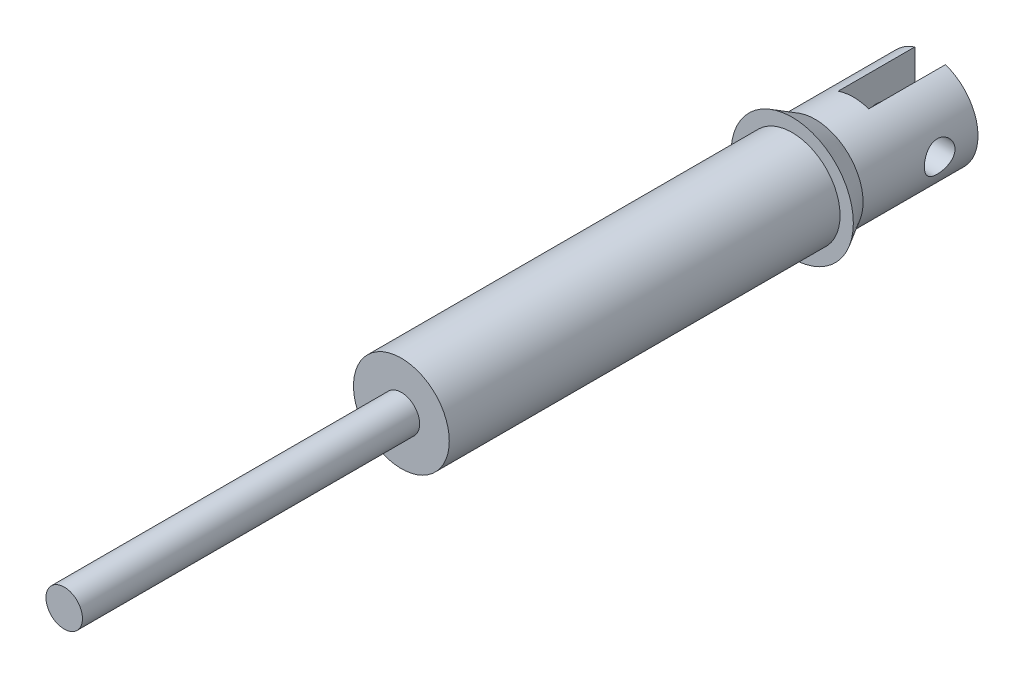
from build123d import *

# Parameters (mm, degrees)
SKETCH1_R               = 6.25
BOSS_EXTRUDE1_DEPTH     = 15
SKETCH2_R               = 6.25
BOSS_EXTRUDE2_DEPTH     = 3
BOSS_EXTRUDE2_DRAFT     = -30
SKETCH3_R               = 6.25
BOSS_EXTRUDE3_DEPTH     = 51
SKETCH4_R               = 2.38125
BOSS_EXTRUDE4_DEPTH     = 44
SKETCH5_W               = 4
SKETCH5_H               = 14.941049413
CUT_EXTRUDE1_DEPTH      = 10
CUT_EXTRUDE2_DEPTH      = 114.720510346
CUT_EXTRUDE2_DEPTH_BACK = 114.720510346
SKETCH6_R               = 2


with BuildPart() as part:
    # Sketch1 → Boss-Extrude1 (new body)
    with BuildSketch(Plane.XY):
        Circle(SKETCH1_R)
    extrude(amount=BOSS_EXTRUDE1_DEPTH)


with BuildPart() as boss_extrude2_tool:
    # Sketch2 → Boss-Extrude2 (with draft: the straight prism first)
    with BuildSketch(Plane.XY.offset(15)):
        Circle(SKETCH2_R)
    extrude(amount=BOSS_EXTRUDE2_DEPTH)
    # Boss-Extrude2: the draft: its side faces are tilted about the plane it starts from
    boss_extrude2_sides = [boss_extrude2_tool.faces().sort_by_distance(p)[0] for p in [
        (-6.25, 0, 16.5),
    ]]
    draft(boss_extrude2_sides, Plane.XY.offset(15), BOSS_EXTRUDE2_DRAFT)


with BuildPart() as part_1:
    add(part.part)

    # Boss-Extrude2: add boss_extrude2_tool
    add(boss_extrude2_tool.part)

    # Sketch3 → Boss-Extrude3 (add)
    with BuildSketch(Plane.XY.offset(18)):
        Circle(SKETCH3_R)
    extrude(amount=BOSS_EXTRUDE3_DEPTH)

    # Sketch4 → Boss-Extrude4 (add)
    with BuildSketch(Plane.XY.offset(69)):
        Circle(SKETCH4_R)
    extrude(amount=BOSS_EXTRUDE4_DEPTH)

    # Sketch5 → Cut-Extrude1 (cut)
    with BuildSketch(Plane(origin=(0, 0, 0), x_dir=(-1, 0, 0), z_dir=(0, 0, -1))):
        with Locations((0, 0.333395318)):
            Rectangle(SKETCH5_W, SKETCH5_H)
    extrude(amount=-CUT_EXTRUDE1_DEPTH, mode=Mode.SUBTRACT)

    # Sketch6 → Cut-Extrude2 (cut, two sides: drawn at the far end of the back side and taken through both)
    with BuildSketch(Plane.ZY.offset(-2).offset(-CUT_EXTRUDE2_DEPTH_BACK)):
        with Locations(Location((5, 0, 0), (0, 0, 270))):
            Circle(SKETCH6_R)
    extrude(amount=CUT_EXTRUDE2_DEPTH + CUT_EXTRUDE2_DEPTH_BACK, mode=Mode.SUBTRACT)


solid = part_1.part
